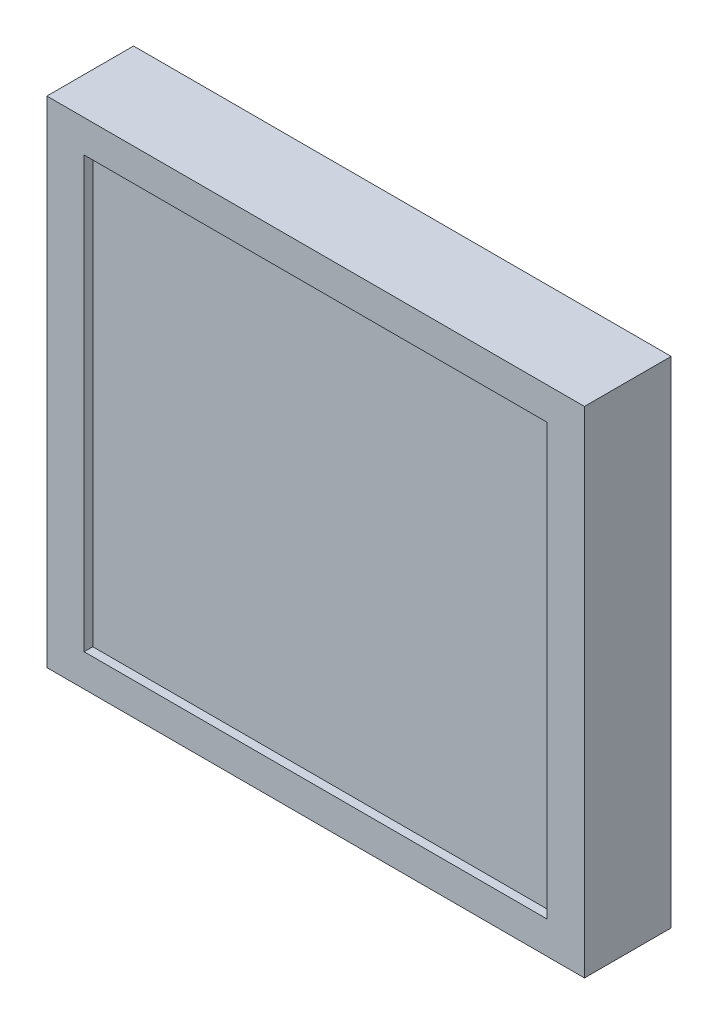
from build123d import *

# Parameters (mm, degrees)
SKETCH_1_W          = 12.403389008
SKETCH_1_H          = 11.420638786
EXTRUDE_1_DEPTH     = 2
SKETCH_2_W          = 10.683629374
SKETCH_2_H          = 9.926283246
CUT_EXTRUDE_1_DEPTH = 0.2


with BuildPart() as part:
    # 草图1 → 凸台-拉伸1 (new body)
    with BuildSketch(Plane.XY):
        Rectangle(SKETCH_1_W, SKETCH_1_H)
    extrude(amount=EXTRUDE_1_DEPTH)

    # 草图2 → 切除-拉伸1 (cut)
    with BuildSketch(Plane.XY.offset(2)):
        Rectangle(SKETCH_2_W, SKETCH_2_H)
    extrude(amount=-CUT_EXTRUDE_1_DEPTH, mode=Mode.SUBTRACT)


solid = part.part
